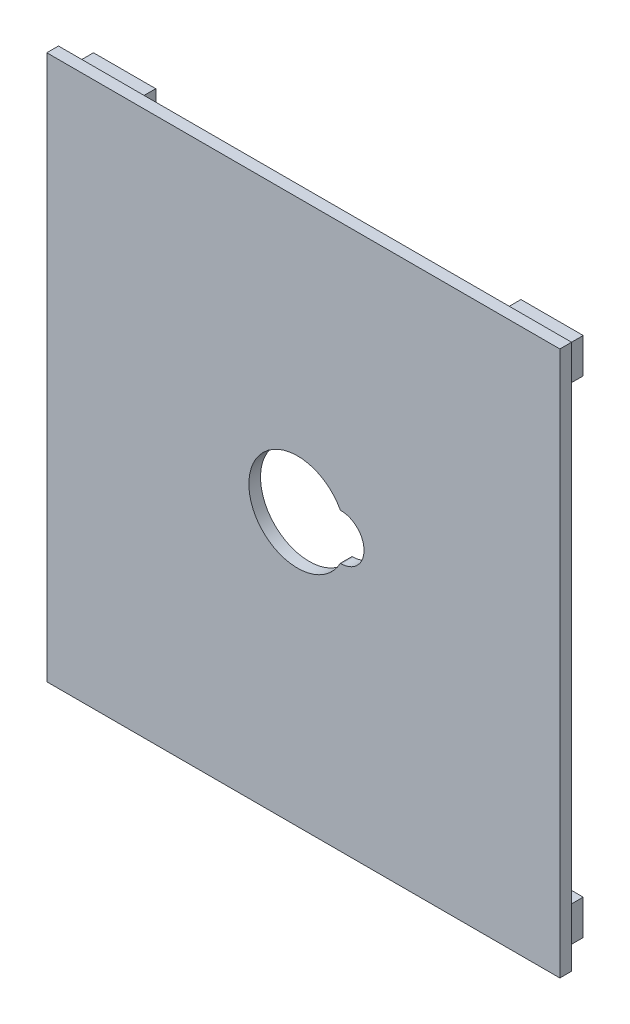
from build123d import *

# Parameters (mm, degrees)
SKETCH1_W                 = 65.925
SKETCH1_H                 = 70
BOSS_EXTRUDE1_DEPTH       = 1.5
CUT_EXTRUDE1_REACH        = 137.268
SKETCH4_W                 = 8
SKETCH4_H                 = 4.5
SKETCH4_W_2               = 5
SKETCH4_H_2               = 1.5
BOSS_EXTRUDE2_DEPTH       = 3
MIRROR2_COPY_1_SKETCH_W   = 8
MIRROR2_COPY_1_SKETCH_H   = 4.5
MIRROR2_COPY_1_SKETCH_W_2 = 5
MIRROR2_COPY_1_SKETCH_H_2 = 1.5
MIRROR2_COPY_1_DEPTH      = 3


with BuildPart() as part:
    # Sketch1 → Boss-Extrude1 (new body)
    with BuildSketch(Plane.XY):
        with Locations((88.1375, 25.25)):
            Rectangle(SKETCH1_W, SKETCH1_H)
    extrude(amount=BOSS_EXTRUDE1_DEPTH)

    # Sketch2 → Cut-Extrude1 (cut, up to next)
    with BuildSketch(Plane.XY.offset(1.5), mode=Mode.PRIVATE) as cut_extrude1_sk1:
        with BuildLine():
            Line((92.897490926, 22.3), (92.9875, 22.3))
            ThreePointArc((92.9875, 22.3), (95.9375, 25.25), (92.9875, 28.2))
            Line((92.9875, 28.2), (92.897490926, 28.2))
            ThreePointArc((92.897490926, 28.2), (81.1375, 25.25), (92.897490926, 22.3))
        make_face()
    cut_extrude1_tool1 = extrude(cut_extrude1_sk1.sketch, amount=-CUT_EXTRUDE1_REACH, mode=Mode.PRIVATE) & part.part
    add(cut_extrude1_tool1.solids().sort_by_distance((87.980915, 25.25, 1.5))[0], mode=Mode.SUBTRACT)

    # Sketch4 → Boss-Extrude2 (add)
    with BuildSketch(Plane(origin=(0, 0, 0), x_dir=(-1, 0, 0), z_dir=(0, 0, -1))):
        with Locations((-115.6, 56.5)):
            Rectangle(SKETCH4_W, SKETCH4_H)
        with Locations((-115.6, 56.5)):
            Rectangle(SKETCH4_W_2, SKETCH4_H_2, mode=Mode.SUBTRACT)
    boss_extrude2 = extrude(amount=BOSS_EXTRUDE2_DEPTH)

    # Mirror1: Boss-Extrude2 across plane
    add(boss_extrude2.mirror(Plane(origin=(88.1375, 0, 0), x_dir=(0, 0, 1), z_dir=(1, 0, 0))))

    # Mirror2: Boss-Extrude2 across plane
    add(boss_extrude2.mirror(Plane.ZX.offset(25.25)))

    # Mirror2 copy 1 sketch → Mirror2 copy 1 (add)
    with BuildSketch(Plane(origin=(176.275, 50.5, 0), x_dir=(1, 0, 0), z_dir=(0, 0, -1))):
        with Locations((-115.6, 56.5)):
            Rectangle(MIRROR2_COPY_1_SKETCH_W, MIRROR2_COPY_1_SKETCH_H)
        with Locations((-115.6, 56.5)):
            Rectangle(MIRROR2_COPY_1_SKETCH_W_2, MIRROR2_COPY_1_SKETCH_H_2, mode=Mode.SUBTRACT)
    extrude(amount=MIRROR2_COPY_1_DEPTH)


solid = part.part
